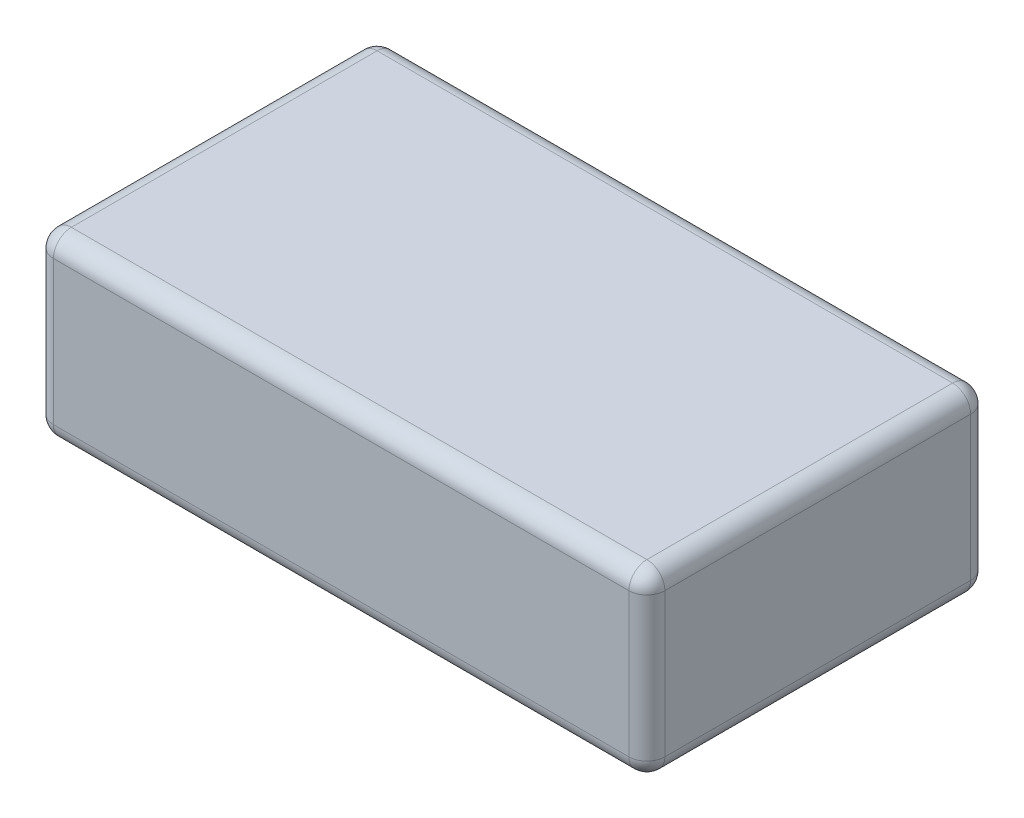
from build123d import *

# Parameters (mm, degrees)
SKETCH1_W           = 68
SKETCH1_H           = 38
BOSS_EXTRUDE1_DEPTH = 20
FILLET1_R           = 2


with BuildPart() as part:
    # Sketch1 → Boss-Extrude1 (new body)
    with BuildSketch(Plane(origin=(0, 0, 0), x_dir=(1, 0, 0), z_dir=(0, 1, 0))):
        Rectangle(SKETCH1_W, SKETCH1_H)
    extrude(amount=BOSS_EXTRUDE1_DEPTH)

    # Fillet1
    fillet1_edges = [part.edges().sort_by_distance(p)[0] for p in [
        (-34, 20, 0),
        (0, 20, 19),
        (34, 20, 0),
        (0, 0, 19),
        (-34, 0, 0),
        (0, 0, -19),
        (34, 0, 0),
        (0, 20, -19),
        (34, 10, 19),
        (-34, 10, 19),
        (-34, 10, -19),
        (34, 10, -19),
    ]]
    fillet(fillet1_edges, radius=FILLET1_R)


solid = part.part
